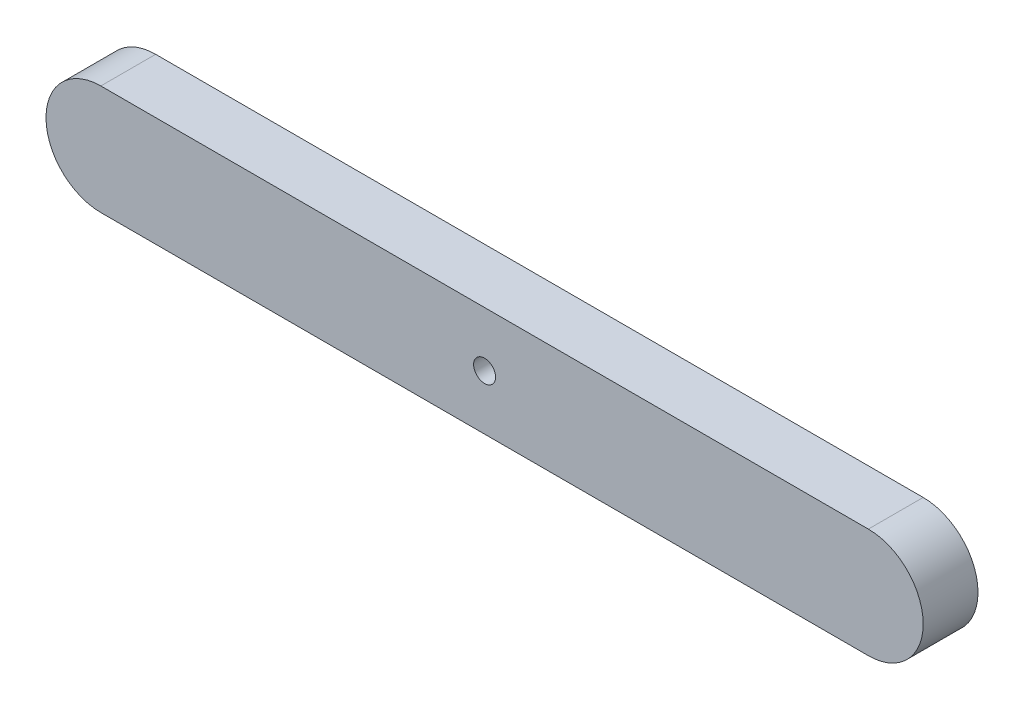
from build123d import *

# Parameters (mm, degrees)
SALIENTE_EXTRUIR2_DEPTH = 5
CROQUIS2_R              = 1
CORTAR_EXTRUIR1_DEPTH   = 10


with BuildPart() as part:
    # Croquis1 → Saliente-Extruir2 (new body)
    with BuildSketch(Plane.XY):
        with BuildLine():
            Line((-35, 5), (35, 5))
            ThreePointArc((35, 5), (40, 0), (35, -5))
            Line((35, -5), (-35, -5))
            ThreePointArc((-35, -5), (-40, 0), (-35, 5))
        make_face()
    extrude(amount=SALIENTE_EXTRUIR2_DEPTH)

    # Croquis2 → Cortar-Extruir1 (cut)
    with BuildSketch(Plane(origin=(0, 0, 0), x_dir=(-1, 0, 0), z_dir=(0, 0, -1))):
        Circle(CROQUIS2_R)
    extrude(amount=-CORTAR_EXTRUIR1_DEPTH, mode=Mode.SUBTRACT)


solid = part.part
